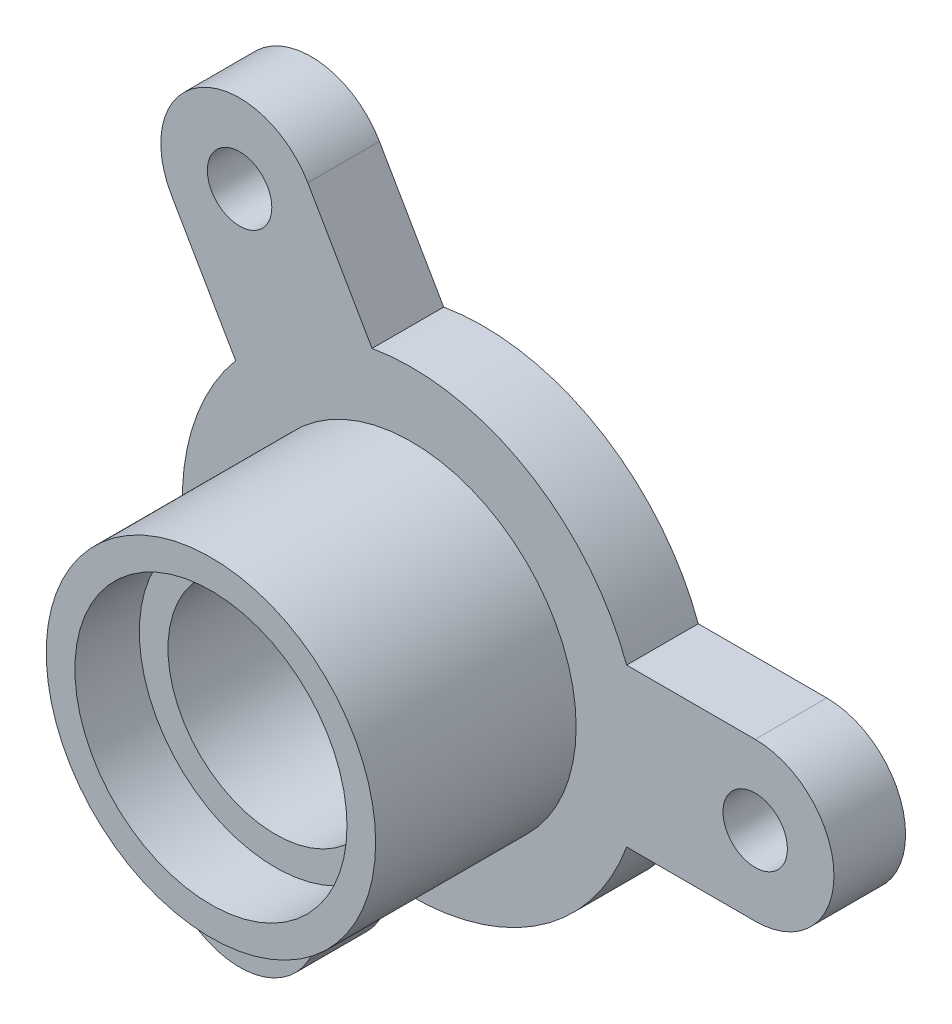
from build123d import *

# Parameters (mm, degrees)
SKETCH_1_R               = 32
EXTRUDE_1_DEPTH          = 10
EXTRUDE_2_DEPTH          = 10
PATTERN_CIRCULAR_1_COUNT = 3
SKETCH_3_R               = 23
EXTRUDE_3_DEPTH          = 28
SKETCH_4_R               = 15
CUT_EXTRUDE_1_DEPTH      = 88.68422222
SKETCH_5_R               = 19
CUT_EXTRUDE_2_DEPTH      = 9
SKETCH_6_R               = 4.5
CUT_EXTRUDE_3_DEPTH      = 84.836285858


with BuildPart() as part:
    # 草图1 → 凸台-拉伸1 (new body)
    with BuildSketch(Plane.XY):
        Circle(SKETCH_1_R)
    extrude(amount=EXTRUDE_1_DEPTH)

    # 草图2 → 凸台-拉伸2 (add)
    with BuildSketch(Plane.XY):
        with BuildLine():
            Line((20, -11), (48, -11))
            ThreePointArc((48, -11), (59, 0), (48, 11))
            Line((48, 11), (20, 11))
            ThreePointArc((20, 11), (9, 0), (20, -11))
        make_face()
    extrude_2 = extrude(amount=EXTRUDE_2_DEPTH)

    # 阵列(圆周)1: 凸台-拉伸2 ×3 about axis
    pattern_circular_1_axis = Axis((0, 0, 10.5), (0, 0, -1))
    for i in range(1, PATTERN_CIRCULAR_1_COUNT):
        add(extrude_2.rotate(pattern_circular_1_axis, i * 360 / PATTERN_CIRCULAR_1_COUNT))

    # 草图3 → 凸台-拉伸3 (add)
    with BuildSketch(Plane.XY.offset(10)):
        Circle(SKETCH_3_R)
    extrude(amount=EXTRUDE_3_DEPTH)

    # 草图4 → 切除-拉伸1 (cut, through all)
    with BuildSketch(Plane.XY.offset(38)):
        Circle(SKETCH_4_R)
    extrude(amount=-CUT_EXTRUDE_1_DEPTH, mode=Mode.SUBTRACT)

    # 草图5 → 切除-拉伸2 (cut)
    with BuildSketch(Plane.XY.offset(38)):
        Circle(SKETCH_5_R)
    extrude(amount=-CUT_EXTRUDE_2_DEPTH, mode=Mode.SUBTRACT)

    # 草图6 → 切除-拉伸3 (cut, through all)
    with BuildSketch(Plane.XY.offset(10)):
        with Locations((48, 0)):
            Circle(SKETCH_6_R)
        with Locations((-24, 41.569219)):
            Circle(SKETCH_6_R)
        with Locations((-24, -41.569219)):
            Circle(SKETCH_6_R)
    extrude(amount=-CUT_EXTRUDE_3_DEPTH, mode=Mode.SUBTRACT)


solid = part.part
